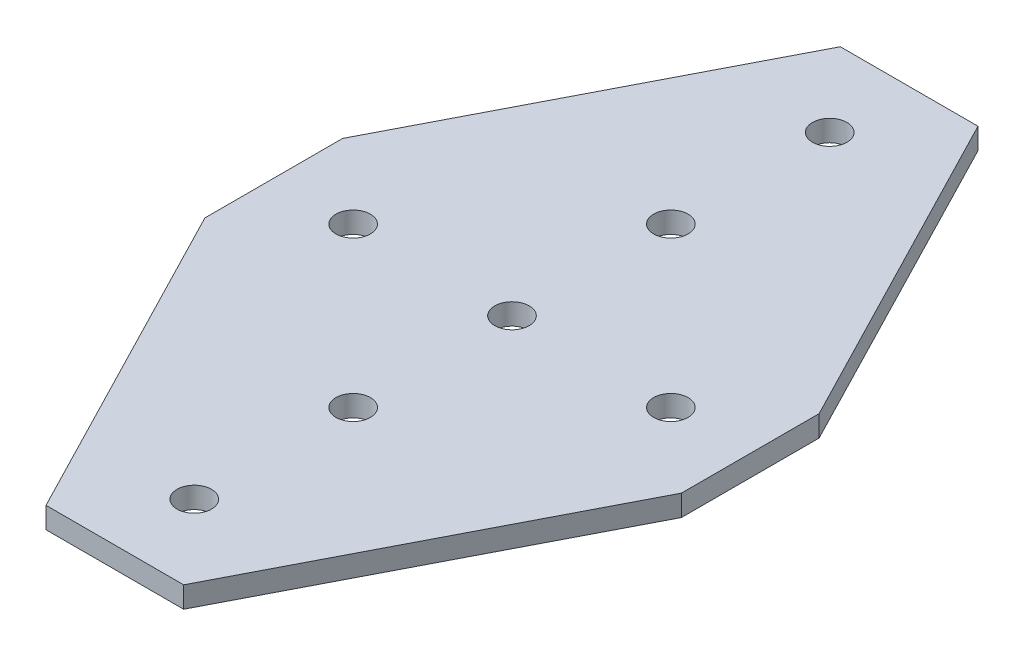
from build123d import *

# Parameters (mm, degrees)
BOSS_EXTRUDE1_DEPTH = 4
SKETCH3_R           = 3.25
CUT_EXTRUDE1_DEPTH  = 157.655673373


with BuildPart() as part:
    # Sketch1 → Boss-Extrude1 (new body)
    with BuildSketch(Plane(origin=(0, 0, 0), x_dir=(1, 0, 0), z_dir=(0, 1, 0))):
        Polygon((-13, 0), (13, 0), (45, 62), (45, 88), (13, 150), (-13, 150), (-45, 88), (-45, 62), align=None)
    extrude(amount=BOSS_EXTRUDE1_DEPTH)

    # Sketch3 → Cut-Extrude1 (cut, through all)
    with BuildSketch(Plane(origin=(0, 4, 0), x_dir=(1, 0, 0), z_dir=(0, 1, 0))):
        with Locations(Location((0, 75, 0), (0, 0, 270))):
            Circle(SKETCH3_R)
        with Locations(Location((30, 75, 0), (0, 0, 270))):
            Circle(SKETCH3_R)
        with Locations(Location((-30, 75, 0), (0, 0, 270))):
            Circle(SKETCH3_R)
        with Locations(Location((0, 105, 0), (0, 0, 270))):
            Circle(SKETCH3_R)
        with Locations(Location((0, 135, 0), (0, 0, 270))):
            Circle(SKETCH3_R)
        with Locations(Location((0, 45, 0), (0, 0, 270))):
            Circle(SKETCH3_R)
        with Locations(Location((0, 15, 0), (0, 0, 270))):
            Circle(SKETCH3_R)
    extrude(amount=-CUT_EXTRUDE1_DEPTH, mode=Mode.SUBTRACT)


solid = part.part
